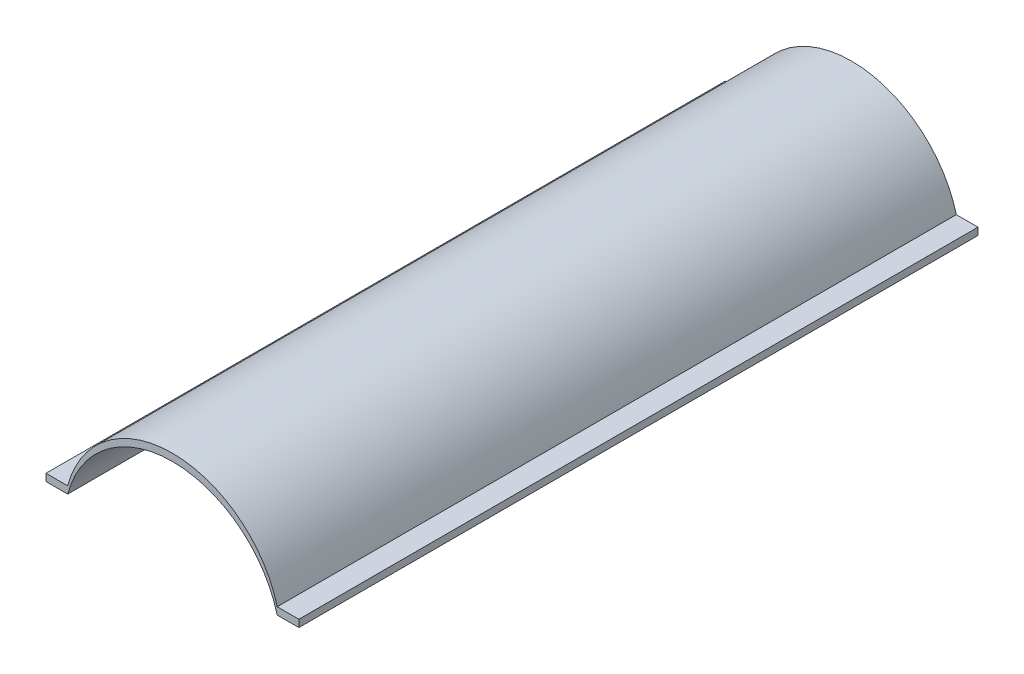
from build123d import *

# Parameters (mm, degrees)
BOSS_EXTRUDE1_DEPTH = 188


with BuildPart() as part:
    # Sketch1 → Boss-Extrude1 (new body)
    with BuildSketch(Plane.XY):
        with BuildLine():
            Line((-8.457027027, 0.580140625), (-8.457027027, 2.580140625))
            Line((-8.457027027, 2.580140625), (-2.457027027, 2.580140625))
            ThreePointArc((-2.457027027, 2.580140625), (26.542972973, 24.898994877), (55.542972973, 2.580140625))
            Line((55.542972973, 2.580140625), (61.542972973, 2.580140625))
            Line((61.542972973, 2.580140625), (61.542972973, 0.580140625))
            Line((61.542972973, 0.580140625), (55.542972973, 0.580140625))
            ThreePointArc((55.542972973, 0.580140625), (26.542972973, 22.898994877), (-2.457027027, 0.580140625))
            Line((-2.457027027, 0.580140625), (-8.457027027, 0.580140625))
        make_face()
    extrude(amount=BOSS_EXTRUDE1_DEPTH)


solid = part.part
